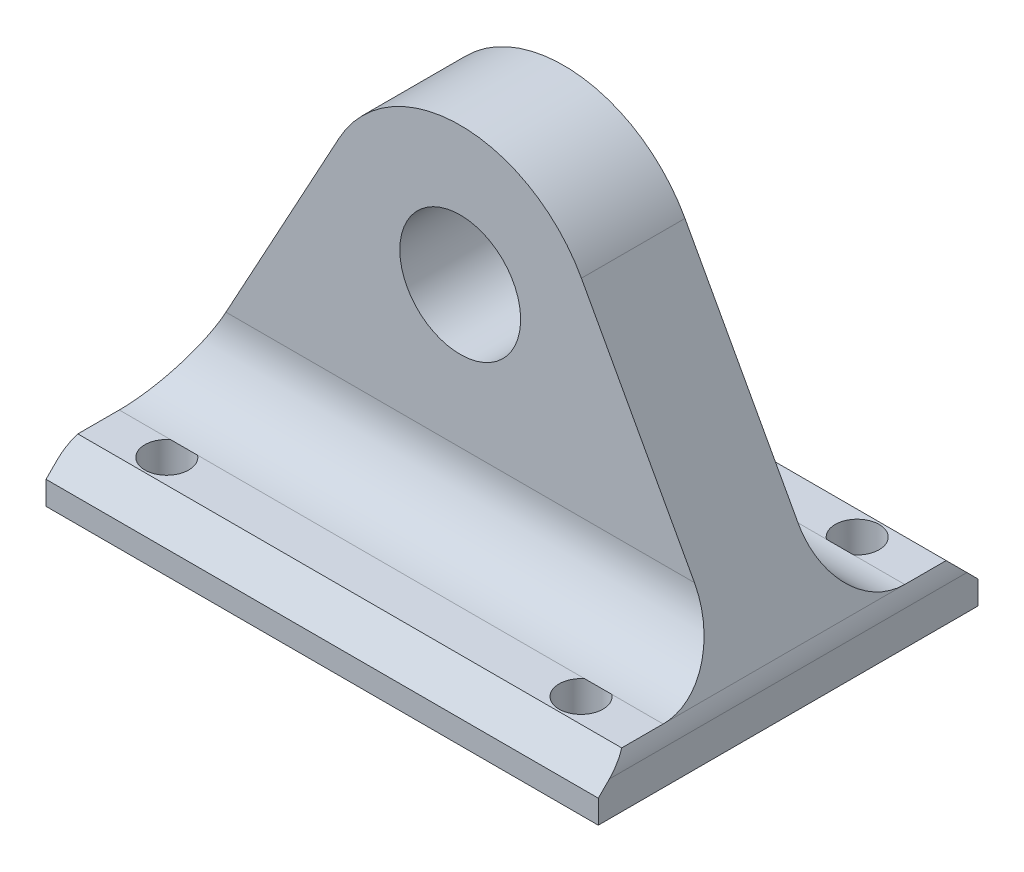
from build123d import *

# Parameters (mm, degrees)
SKETCH1_R                       = 5.55625
BOSS_EXTRUDE1_DEPTH             = 9.525
BOSS_EXTRUDE2_DEPTH             = 12.7
CHAMFER3_SIZE                   = 2.54
BOSS_EXTRUDE3_START             = 12.7
BOSS_EXTRUDE3_DEPTH             = 12.7
CHAMFER4_SIZE                   = 2.54
FILLET4_R                       = 6.35
SKETCH9_W                       = 2.0193
SKETCH9_H                       = 4.6961896
F_10_32_TAPPED_HOLE1_AT_2_COUNT = 2
F_10_32_TAPPED_HOLE1_AT_2_PITCH = 38.1
F_10_32_TAPPED_HOLE1_AT_3_COUNT = 2
F_10_32_TAPPED_HOLE1_AT_3_PITCH = 45.790501198
F_10_32_TAPPED_HOLE1_AT_4_COUNT = 2
F_10_32_TAPPED_HOLE1_AT_4_PITCH = 25.4


with BuildPart() as part:
    # Sketch1 → Boss-Extrude1 (new body)
    with BuildSketch(Plane.XY):
        with BuildLine():
            Line((0, -3.175), (44.45, -3.175))
            Line((44.45, -3.175), (47.625, -3.175))
            Line((47.625, -3.175), (47.625, 0))
            ThreePointArc((47.625, 0), (47.52643593, 0.784963037), (47.236863327, 1.5211896))
            Line((47.236863327, 1.5211896), (33.372453307, 26.9211896))
            ThreePointArc((33.372453307, 26.9211896), (22.225, 33.536431201), (11.077546693, 26.9211896))
            Line((11.077546693, 26.9211896), (-2.786863327, 1.5211896))
            ThreePointArc((-2.786863327, 1.5211896), (-3.07643593, 0.784963037), (-3.175, 0))
            Line((-3.175, 0), (-3.175, -3.175))
            Line((-3.175, -3.175), (0, -3.175))
        make_face()
        with Locations(Location((22.225, 20.836431201, 0), (0, 0, 180))):
            Circle(SKETCH1_R, mode=Mode.SUBTRACT)
    extrude(amount=BOSS_EXTRUDE1_DEPTH)

    # Sketch4 → Boss-Extrude2 (add)
    with BuildSketch(Plane.XY.offset(9.525)):
        with BuildLine():
            Line((47.625, -3.175), (47.625, 0))
            ThreePointArc((47.625, 0), (47.52643593, 0.784963037), (47.236863327, 1.5211896))
            Line((47.236863327, 1.5211896), (-2.786863327, 1.5211896))
            ThreePointArc((-2.786863327, 1.5211896), (-3.07643593, 0.784963037), (-3.175, 0))
            Line((-3.175, 0), (-3.175, -3.175))
            Line((-3.175, -3.175), (47.625, -3.175))
        make_face()
    extrude(amount=BOSS_EXTRUDE2_DEPTH)

    # Chamfer3
    chamfer3_edges = [part.edges().sort_by_distance(p)[0] for p in [
        (22.225, 1.5211896, 22.225),
    ]]
    chamfer(chamfer3_edges, length=CHAMFER3_SIZE)

    # Sketch6 → Boss-Extrude3 (add)
    with BuildSketch(Plane(origin=(0, 0, 0), x_dir=(-1, 0, 0), z_dir=(0, 0, -1)).offset(BOSS_EXTRUDE3_START)):
        with BuildLine():
            Line((3.175, 0), (3.175, -3.175))
            Line((3.175, -3.175), (-47.625, -3.175))
            Line((-47.625, -3.175), (-47.625, 0))
            ThreePointArc((-47.625, 0), (-47.52643593, 0.784963037), (-47.236863327, 1.5211896))
            Line((-47.236863327, 1.5211896), (2.786863327, 1.5211896))
            ThreePointArc((2.786863327, 1.5211896), (3.07643593, 0.784963037), (3.175, 0))
        make_face()
    extrude(amount=-BOSS_EXTRUDE3_DEPTH)

    # Chamfer4
    chamfer4_edges = [part.edges().sort_by_distance(p)[0] for p in [
        (22.225, 1.5211896, -12.7),
    ]]
    chamfer(chamfer4_edges, length=CHAMFER4_SIZE)

    # Fillet4
    fillet4_edges = [part.edges().sort_by_distance(p)[0] for p in [
        (22.225, 1.5211896, 9.525),
        (22.225, 1.5211896, 0),
    ]]
    fillet(fillet4_edges, radius=FILLET4_R)

    # Sketch9 → #10-32 Tapped Hole1 (revolve, cut)
    with BuildSketch(Plane(origin=(3.175, 1.5211896, -7.9375), x_dir=(0, 0, 1), z_dir=(1, 0, 0))):
        with Locations((1.00965, 2.3480948)):
            Rectangle(SKETCH9_W, SKETCH9_H)
    f_10_32_tapped_hole1 = revolve(axis=Axis((3.175, 7.8711896, -7.9375), (0, -1, 0)), mode=Mode.SUBTRACT)

    # #10-32 Tapped Hole1 at 2: #10-32 Tapped Hole1 ×2
    with Locations(*[(i * F_10_32_TAPPED_HOLE1_AT_2_PITCH, 0, 0) for i in range(1, F_10_32_TAPPED_HOLE1_AT_2_COUNT)]):
        add(f_10_32_tapped_hole1, mode=Mode.SUBTRACT)

    # #10-32 Tapped Hole1 at 3: #10-32 Tapped Hole1 ×2
    with Locations(*[Vector(0.8320502943378437, 0, 0.5547001962252291) * (i * F_10_32_TAPPED_HOLE1_AT_3_PITCH) for i in range(1, F_10_32_TAPPED_HOLE1_AT_3_COUNT)]):
        add(f_10_32_tapped_hole1, mode=Mode.SUBTRACT)

    # #10-32 Tapped Hole1 at 4: #10-32 Tapped Hole1 ×2
    with Locations(*[(0, 0, i * F_10_32_TAPPED_HOLE1_AT_4_PITCH) for i in range(1, F_10_32_TAPPED_HOLE1_AT_4_COUNT)]):
        add(f_10_32_tapped_hole1, mode=Mode.SUBTRACT)


solid = part.part
